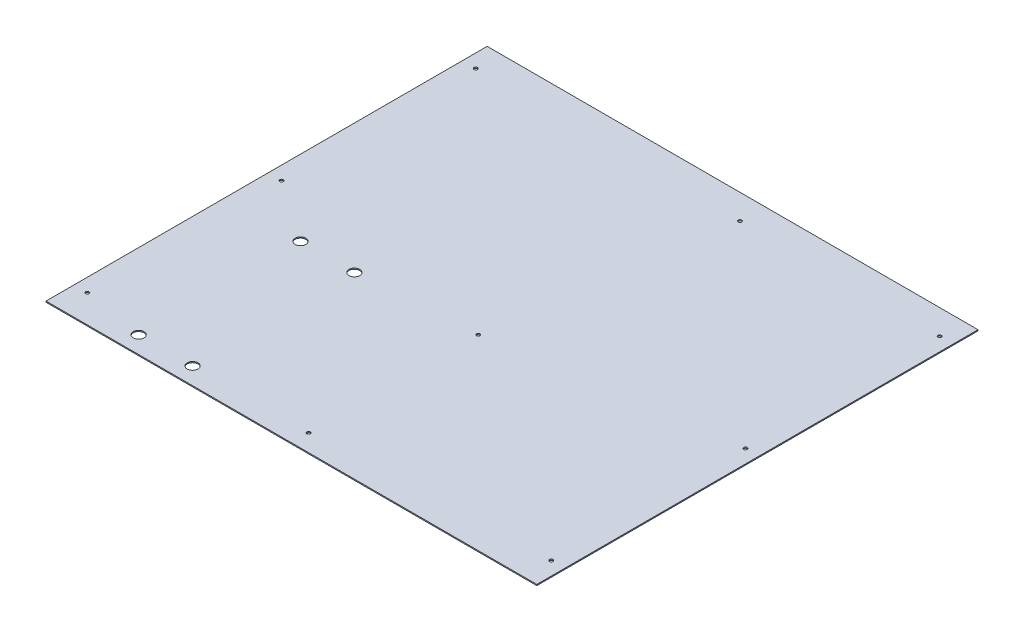
from build123d import *

# Parameters (mm, degrees)
CROQUIS1_W              = 455
CROQUIS1_H              = 409
SALIENTE_EXTRUIR1_DEPTH = 1
CORTAR_EXTRUIR1_REACH   = 307.904
CROQUIS2_R              = 1.6
CORTAR_EXTRUIR2_REACH   = 307.904
CROQUIS3_R              = 5
CORTAR_EXTRUIR3_REACH   = 307.904
CROQUIS4_R              = 1.6


with BuildPart() as part:
    # Croquis1 → Saliente-Extruir1 (new body)
    with BuildSketch(Plane(origin=(0, 0, 0), x_dir=(1, 0, 0), z_dir=(0, 1, 0))):
        Rectangle(CROQUIS1_W, CROQUIS1_H)
    extrude(amount=SALIENTE_EXTRUIR1_DEPTH)

    # Croquis2 → Cortar-Extruir1 (cut, up to next)
    with BuildSketch(Plane.XZ, mode=Mode.PRIVATE) as cortar_extruir1_sk1:
        with Locations(Location((-215, 178.6, 0), (0, 0, 270))):
            Circle(CROQUIS2_R)
    cortar_extruir1_tool1 = extrude(cortar_extruir1_sk1.sketch, amount=-CORTAR_EXTRUIR1_REACH, mode=Mode.PRIVATE) & part.part
    # Croquis2 → Cortar-Extruir1 (cut, up to next)
    with BuildSketch(Plane.XZ, mode=Mode.PRIVATE) as cortar_extruir1_sk2:
        with Locations(Location((-215, -181.4, 0), (0, 0, 270))):
            Circle(CROQUIS2_R)
    cortar_extruir1_tool2 = extrude(cortar_extruir1_sk2.sketch, amount=-CORTAR_EXTRUIR1_REACH, mode=Mode.PRIVATE) & part.part
    # Croquis2 → Cortar-Extruir1 (cut, up to next)
    with BuildSketch(Plane.XZ, mode=Mode.PRIVATE) as cortar_extruir1_sk3:
        with Locations(Location((215, -181.4, 0), (0, 0, 270))):
            Circle(CROQUIS2_R)
    cortar_extruir1_tool3 = extrude(cortar_extruir1_sk3.sketch, amount=-CORTAR_EXTRUIR1_REACH, mode=Mode.PRIVATE) & part.part
    # Croquis2 → Cortar-Extruir1 (cut, up to next)
    with BuildSketch(Plane.XZ, mode=Mode.PRIVATE) as cortar_extruir1_sk4:
        with Locations(Location((215, 178.6, 0), (0, 0, 270))):
            Circle(CROQUIS2_R)
    cortar_extruir1_tool4 = extrude(cortar_extruir1_sk4.sketch, amount=-CORTAR_EXTRUIR1_REACH, mode=Mode.PRIVATE) & part.part
    # Croquis2 → Cortar-Extruir1 (cut, up to next)
    with BuildSketch(Plane.XZ, mode=Mode.PRIVATE) as cortar_extruir1_sk5:
        with Locations(Location((0, 31.25, 0), (0, 0, 270))):
            Circle(CROQUIS2_R)
    cortar_extruir1_tool5 = extrude(cortar_extruir1_sk5.sketch, amount=-CORTAR_EXTRUIR1_REACH, mode=Mode.PRIVATE) & part.part
    add(cortar_extruir1_tool1.solids().sort_by_distance((-215, 0, 178.6))[0], mode=Mode.SUBTRACT)
    add(cortar_extruir1_tool2.solids().sort_by_distance((-215, 0, -181.4))[0], mode=Mode.SUBTRACT)
    add(cortar_extruir1_tool3.solids().sort_by_distance((215, 0, -181.4))[0], mode=Mode.SUBTRACT)
    add(cortar_extruir1_tool4.solids().sort_by_distance((215, 0, 178.6))[0], mode=Mode.SUBTRACT)
    add(cortar_extruir1_tool5.solids().sort_by_distance((0, 0, 31.25))[0], mode=Mode.SUBTRACT)

    # Croquis3 → Cortar-Extruir2 (cut, up to next)
    with BuildSketch(Plane.XZ, mode=Mode.PRIVATE) as cortar_extruir2_sk1:
        with Locations(Location((-157.5, 38.6, 0), (0, 0, 270))):
            Circle(CROQUIS3_R)
    cortar_extruir2_tool1 = extrude(cortar_extruir2_sk1.sketch, amount=-CORTAR_EXTRUIR2_REACH, mode=Mode.PRIVATE) & part.part
    # Croquis3 → Cortar-Extruir2 (cut, up to next)
    with BuildSketch(Plane.XZ, mode=Mode.PRIVATE) as cortar_extruir2_sk2:
        with Locations(Location((-107.5, 38.6, 0), (0, 0, 270))):
            Circle(CROQUIS3_R)
    cortar_extruir2_tool2 = extrude(cortar_extruir2_sk2.sketch, amount=-CORTAR_EXTRUIR2_REACH, mode=Mode.PRIVATE) & part.part
    # Croquis3 → Cortar-Extruir2 (cut, up to next)
    with BuildSketch(Plane.XZ, mode=Mode.PRIVATE) as cortar_extruir2_sk3:
        with Locations(Location((-107.5, 188.6, 0), (0, 0, 270))):
            Circle(CROQUIS3_R)
    cortar_extruir2_tool3 = extrude(cortar_extruir2_sk3.sketch, amount=-CORTAR_EXTRUIR2_REACH, mode=Mode.PRIVATE) & part.part
    # Croquis3 → Cortar-Extruir2 (cut, up to next)
    with BuildSketch(Plane.XZ, mode=Mode.PRIVATE) as cortar_extruir2_sk4:
        with Locations(Location((-157.5, 188.6, 0), (0, 0, 270))):
            Circle(CROQUIS3_R)
    cortar_extruir2_tool4 = extrude(cortar_extruir2_sk4.sketch, amount=-CORTAR_EXTRUIR2_REACH, mode=Mode.PRIVATE) & part.part
    add(cortar_extruir2_tool1.solids().sort_by_distance((-157.5, 0, 38.6))[0], mode=Mode.SUBTRACT)
    add(cortar_extruir2_tool2.solids().sort_by_distance((-107.5, 0, 38.6))[0], mode=Mode.SUBTRACT)
    add(cortar_extruir2_tool3.solids().sort_by_distance((-107.5, 0, 188.6))[0], mode=Mode.SUBTRACT)
    add(cortar_extruir2_tool4.solids().sort_by_distance((-157.5, 0, 188.6))[0], mode=Mode.SUBTRACT)

    # Croquis4 → Cortar-Extruir3 (cut, up to next)
    with BuildSketch(Plane.XZ, mode=Mode.PRIVATE) as cortar_extruir3_sk1:
        with Locations(Location((-215, -1.4, 0), (0, 0, 270))):
            Circle(CROQUIS4_R)
    cortar_extruir3_tool1 = extrude(cortar_extruir3_sk1.sketch, amount=-CORTAR_EXTRUIR3_REACH, mode=Mode.PRIVATE) & part.part
    # Croquis4 → Cortar-Extruir3 (cut, up to next)
    with BuildSketch(Plane.XZ, mode=Mode.PRIVATE) as cortar_extruir3_sk2:
        with Locations(Location((215, -1.4, 0), (0, 0, 270))):
            Circle(CROQUIS4_R)
    cortar_extruir3_tool2 = extrude(cortar_extruir3_sk2.sketch, amount=-CORTAR_EXTRUIR3_REACH, mode=Mode.PRIVATE) & part.part
    # Croquis4 → Cortar-Extruir3 (cut, up to next)
    with BuildSketch(Plane.XZ, mode=Mode.PRIVATE) as cortar_extruir3_sk3:
        with Locations(Location((0, 188.6, 0), (0, 0, 270))):
            Circle(CROQUIS4_R)
    cortar_extruir3_tool3 = extrude(cortar_extruir3_sk3.sketch, amount=-CORTAR_EXTRUIR3_REACH, mode=Mode.PRIVATE) & part.part
    # Croquis4 → Cortar-Extruir3 (cut, up to next)
    with BuildSketch(Plane.XZ, mode=Mode.PRIVATE) as cortar_extruir3_sk4:
        with Locations(Location((30, -181.4, 0), (0, 0, 270))):
            Circle(CROQUIS4_R)
    cortar_extruir3_tool4 = extrude(cortar_extruir3_sk4.sketch, amount=-CORTAR_EXTRUIR3_REACH, mode=Mode.PRIVATE) & part.part
    add(cortar_extruir3_tool1.solids().sort_by_distance((-215, 0, -1.4))[0], mode=Mode.SUBTRACT)
    add(cortar_extruir3_tool2.solids().sort_by_distance((215, 0, -1.4))[0], mode=Mode.SUBTRACT)
    add(cortar_extruir3_tool3.solids().sort_by_distance((0, 0, 188.6))[0], mode=Mode.SUBTRACT)
    add(cortar_extruir3_tool4.solids().sort_by_distance((30, 0, -181.4))[0], mode=Mode.SUBTRACT)


solid = part.part
